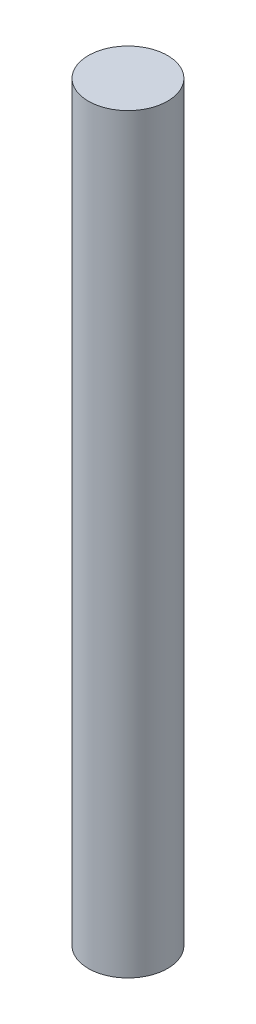
from build123d import *

# Parameters (mm, degrees)
SKETCH1_R           = 1.95
BOSS_EXTRUDE1_DEPTH = 37


with BuildPart() as part:
    # Sketch1 → Boss-Extrude1 (new body)
    with BuildSketch(Plane(origin=(0, 0, 0), x_dir=(1, 0, 0), z_dir=(0, 1, 0))):
        with Locations(Location((0, 0, 0), (0, 0, 270))):
            Circle(SKETCH1_R)
    extrude(amount=BOSS_EXTRUDE1_DEPTH)


solid = part.part
